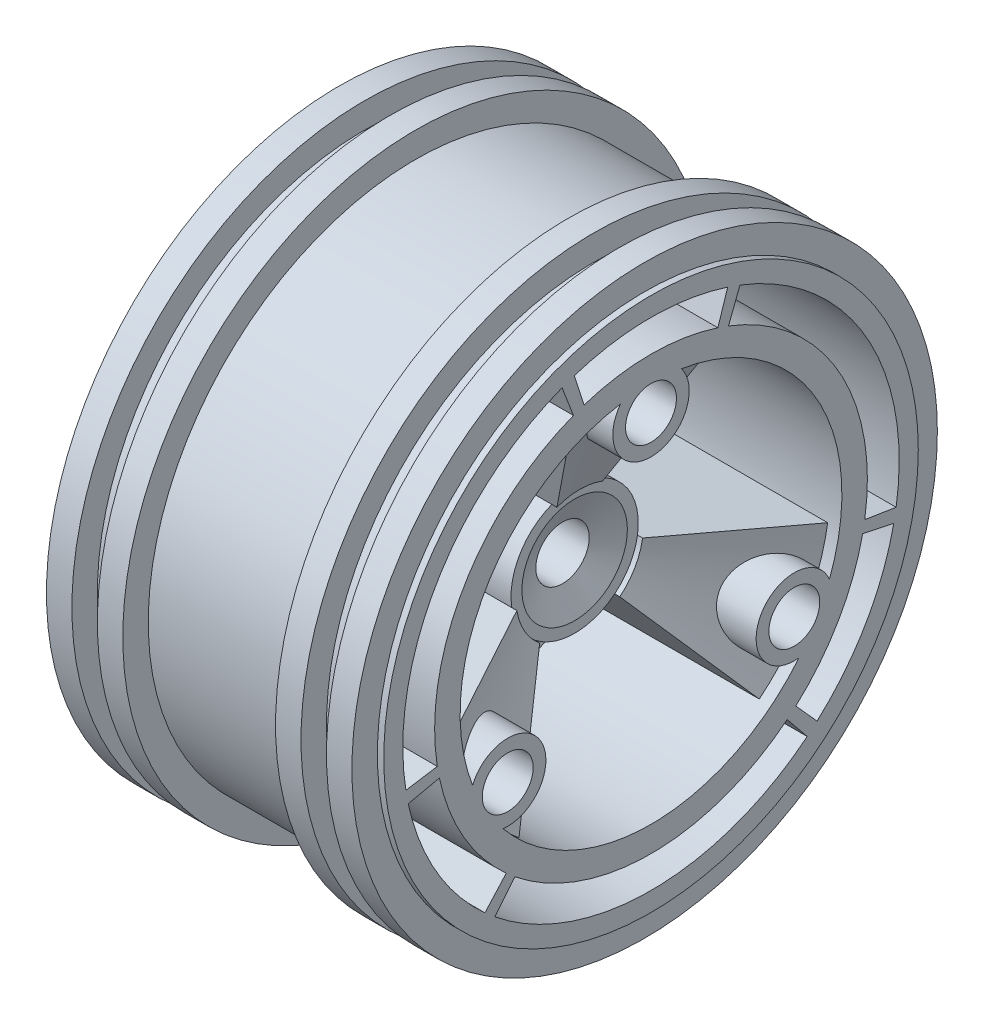
from build123d import *

# Parameters (mm, degrees)
ESQUISSE2_R              = 2
ENL_V_MAT_EXTRU_1_DEPTH  = 20
ESQUISSE2_3_R            = 2.1
ESQUISSE2_3_R_2          = 2
ENL_V_MAT_EXTRU_2_DEPTH  = 20
ENL_V_MAT_EXTRU_3_DEPTH  = 11
ESQUISSE2_6_R            = 3
ENL_V_MAT_EXTRU_4_DEPTH  = 1
ENL_V_MAT_EXTRU_5_DEPTH  = 0.5
ESQUISSE2_8_R            = 19
ESQUISSE2_8_R_2          = 2
BOSS_EXTRU_1_DEPTH       = 19
ENL_V_START              = -15
ENL_V_MAT_EXTRU_6_DEPTH  = 15
ENL_V_START_2            = -6
ENL_V_MAT_EXTRU_9_DEPTH  = 6
ENL_V_START_3            = -14.5
ENL_V_MAT_EXTRU_12_DEPTH = 14.5
ENL_V_MAT_EXTRU_13_DEPTH = 17


with BuildPart() as part:
    # Esquisse1 → Révolution1 (revolve)
    with BuildSketch(Plane.XY):
        Polygon((-6.5, -2), (5.5, -2), (12.5, -17), (12.5, -21), (12, -21), (12, -23), (10, -23), (10, -21), (8, -21), (8, -23), (6, -23), (6, -21), (-6, -21), (-6, -23), (-8, -23), (-8, -21), (-10, -21), (-10, -23), (-12, -23), (-12, -21), (-12.5, -21), (-12.5, -19), (-6.5, -19), align=None)
    revolve(axis=Axis((0, 0, 0), (-1, 0, 0)))

    # Esquisse2 → Enlèv. mat.-Extru.1 (cut)
    with BuildSketch(Plane.ZY.offset(6.5)):
        with Locations((-11.258330249, 6.5)):
            Circle(ESQUISSE2_R)
    extrude(amount=-ENL_V_MAT_EXTRU_1_DEPTH, mode=Mode.SUBTRACT)

    # Esquisse2<3> → Enlèv. mat.-Extru.2 (cut)
    with BuildSketch(Plane.ZY.offset(6.5)):
        Circle(ESQUISSE2_3_R)
        with Locations((11.258330249, -6.5)):
            Circle(ESQUISSE2_3_R_2)
        with Locations((0, 13)):
            Circle(ESQUISSE2_3_R_2)
        with Locations((0, -13)):
            Circle(ESQUISSE2_3_R_2)
        with Locations((-11.258330249, -6.5)):
            Circle(ESQUISSE2_3_R_2)
        with Locations((11.258330249, 6.5)):
            Circle(ESQUISSE2_3_R_2)
    extrude(amount=-ENL_V_MAT_EXTRU_2_DEPTH, mode=Mode.SUBTRACT)

    # Esquisse2<4> → Enlèv. mat.-Extru.3 (cut)
    with BuildSketch(Plane.ZY.offset(6.5)):
        with BuildLine():
            Line((1.710100717, 4.698463104), (5.13030215, 14.095389312))
            ThreePointArc((5.13030215, 14.095389312), (3.779076628, 14.516148933), (2.394211461, 14.807692308))
            ThreePointArc((2.394211461, 14.807692308), (0, 10), (-2.394211461, 14.807692308))
            ThreePointArc((-2.394211461, 14.807692308), (-3.779076628, 14.516148933), (-5.13030215, 14.095389312))
            Line((-5.13030215, 14.095389312), (-1.710100717, 4.698463104))
            ThreePointArc((-1.710100717, 4.698463104), (0, 5), (1.710100717, 4.698463104))
        make_face()
        with BuildLine():
            Line((14.772116295, -2.604722665), (4.924038765, -0.868240888))
            ThreePointArc((4.924038765, -0.868240888), (4.330127019, -2.5), (3.213938048, -3.830222216))
            Line((3.213938048, -3.830222216), (9.641814145, -11.490666647))
            ThreePointArc((9.641814145, -11.490666647), (10.681815427, -10.530850829), (11.626731979, -9.477294101))
            ThreePointArc((11.626731979, -9.477294101), (8.660254038, -5), (14.02094344, -5.330398206))
            ThreePointArc((14.02094344, -5.330398206), (14.460892055, -3.985298104), (14.772116295, -2.604722665))
        make_face()
        with BuildLine():
            ThreePointArc((-3.213938048, -3.830222216), (-4.330127019, -2.5), (-4.924038765, -0.868240888))
            Line((-4.924038765, -0.868240888), (-14.772116295, -2.604722665))
            ThreePointArc((-14.772116295, -2.604722665), (-14.460892055, -3.985298104), (-14.02094344, -5.330398206))
            ThreePointArc((-14.02094344, -5.330398206), (-8.660254038, -5), (-11.626731979, -9.477294101))
            ThreePointArc((-11.626731979, -9.477294101), (-10.681815427, -10.530850829), (-9.641814145, -11.490666647))
            Line((-9.641814145, -11.490666647), (-3.213938048, -3.830222216))
        make_face()
    extrude(amount=-ENL_V_MAT_EXTRU_3_DEPTH, mode=Mode.SUBTRACT)

    # Esquisse2<6> → Enlèv. mat.-Extru.4 (cut)
    with BuildSketch(Plane.ZY.offset(6.5)):
        with BuildLine():
            ThreePointArc((5, 0), (4.095760221, 2.867882182), (1.710100717, 4.698463104))
            ThreePointArc((1.710100717, 4.698463104), (0, 5), (-1.710100717, 4.698463104))
            ThreePointArc((-1.710100717, 4.698463104), (-4.330127019, 2.5), (-4.924038765, -0.868240888))
            ThreePointArc((-4.924038765, -0.868240888), (-4.330127019, -2.5), (-3.213938048, -3.830222216))
            ThreePointArc((-3.213938048, -3.830222216), (0, -5), (3.213938048, -3.830222216))
            ThreePointArc((3.213938048, -3.830222216), (4.330127019, -2.5), (4.924038765, -0.868240888))
            ThreePointArc((4.924038765, -0.868240888), (4.98097349, -0.435778714), (5, 0))
        make_face()
        Circle(ESQUISSE2_6_R, mode=Mode.SUBTRACT)
    extrude(amount=-ENL_V_MAT_EXTRU_4_DEPTH, mode=Mode.SUBTRACT)

    # Esquisse2<7> → Enlèv. mat.-Extru.5 (cut)
    with BuildSketch(Plane.ZY.offset(6.5)):
        with BuildLine():
            ThreePointArc((11.626731979, 9.477294101), (8.690871593, 12.225741325), (5.13030215, 14.095389312))
            Line((5.13030215, 14.095389312), (1.710100717, 4.698463104))
            ThreePointArc((1.710100717, 4.698463104), (4.330127019, 2.5), (4.924038765, -0.868240888))
            Line((4.924038765, -0.868240888), (14.772116295, -2.604722665))
            ThreePointArc((14.772116295, -2.604722665), (14.933238364, 1.413644918), (14.02094344, 5.330398206))
            ThreePointArc((14.02094344, 5.330398206), (8.660254038, 5), (11.626731979, 9.477294101))
        make_face()
        with BuildLine():
            ThreePointArc((-4.924038765, -0.868240888), (-4.330127019, 2.5), (-1.710100717, 4.698463104))
            Line((-1.710100717, 4.698463104), (-5.13030215, 14.095389312))
            ThreePointArc((-5.13030215, 14.095389312), (-8.690871593, 12.225741325), (-11.626731979, 9.477294101))
            ThreePointArc((-11.626731979, 9.477294101), (-8.660254038, 5), (-14.02094344, 5.330398206))
            ThreePointArc((-14.02094344, 5.330398206), (-14.933238364, 1.413644918), (-14.772116295, -2.604722665))
            Line((-14.772116295, -2.604722665), (-4.924038765, -0.868240888))
        make_face()
        with BuildLine():
            Line((9.641814145, -11.490666647), (3.213938048, -3.830222216))
            ThreePointArc((3.213938048, -3.830222216), (0, -5), (-3.213938048, -3.830222216))
            Line((-3.213938048, -3.830222216), (-9.641814145, -11.490666647))
            ThreePointArc((-9.641814145, -11.490666647), (-6.242366771, -13.639386243), (-2.394211461, -14.807692308))
            ThreePointArc((-2.394211461, -14.807692308), (0, -10), (2.394211461, -14.807692308))
            ThreePointArc((2.394211461, -14.807692308), (6.242366771, -13.639386243), (9.641814145, -11.490666647))
        make_face()
    extrude(amount=-ENL_V_MAT_EXTRU_5_DEPTH, mode=Mode.SUBTRACT)

    # Esquisse2<8> → Boss.-Extru.1 (add)
    with BuildSketch(Plane.ZY.offset(6.5)):
        Circle(ESQUISSE2_8_R)
        with Locations((-11.258330249, -6.5)):
            Circle(ESQUISSE2_8_R_2, mode=Mode.SUBTRACT)
        with Locations((0, -13)):
            Circle(ESQUISSE2_8_R_2, mode=Mode.SUBTRACT)
        with BuildLine():
            ThreePointArc((2.394211461, 14.807692308), (3.779076628, 14.516148933), (5.13030215, 14.095389312))
            ThreePointArc((5.13030215, 14.095389312), (8.690871593, 12.225741325), (11.626731979, 9.477294101))
            ThreePointArc((11.626731979, 9.477294101), (8.660254038, 5), (14.02094344, 5.330398206))
            ThreePointArc((14.02094344, 5.330398206), (14.933238364, 1.413644918), (14.772116295, -2.604722665))
            ThreePointArc((14.772116295, -2.604722665), (14.460892055, -3.985298104), (14.02094344, -5.330398206))
            ThreePointArc((14.02094344, -5.330398206), (8.660254038, -5), (11.626731979, -9.477294101))
            ThreePointArc((11.626731979, -9.477294101), (10.681815427, -10.530850829), (9.641814145, -11.490666647))
            ThreePointArc((9.641814145, -11.490666647), (6.242366771, -13.639386243), (2.394211461, -14.807692308))
            ThreePointArc((2.394211461, -14.807692308), (0, -10), (-2.394211461, -14.807692308))
            ThreePointArc((-2.394211461, -14.807692308), (-6.242366771, -13.639386243), (-9.641814145, -11.490666647))
            ThreePointArc((-9.641814145, -11.490666647), (-10.681815427, -10.530850829), (-11.626731979, -9.477294101))
            ThreePointArc((-11.626731979, -9.477294101), (-8.660254038, -5), (-14.02094344, -5.330398206))
            ThreePointArc((-14.02094344, -5.330398206), (-14.460892055, -3.985298104), (-14.772116295, -2.604722665))
            ThreePointArc((-14.772116295, -2.604722665), (-14.933238364, 1.413644918), (-14.02094344, 5.330398206))
            ThreePointArc((-14.02094344, 5.330398206), (-8.660254038, 5), (-11.626731979, 9.477294101))
            ThreePointArc((-11.626731979, 9.477294101), (-8.690871593, 12.225741325), (-5.13030215, 14.095389312))
            ThreePointArc((-5.13030215, 14.095389312), (-3.779076628, 14.516148933), (-2.394211461, 14.807692308))
            ThreePointArc((-2.394211461, 14.807692308), (0, 10), (2.394211461, 14.807692308))
        make_face(mode=Mode.SUBTRACT)
        with Locations((11.258330249, -6.5)):
            Circle(ESQUISSE2_8_R_2, mode=Mode.SUBTRACT)
        with Locations((-11.258330249, 6.5)):
            Circle(ESQUISSE2_8_R_2, mode=Mode.SUBTRACT)
        with Locations((11.258330249, 6.5)):
            Circle(ESQUISSE2_8_R_2, mode=Mode.SUBTRACT)
        with Locations((0, 13)):
            Circle(ESQUISSE2_8_R_2, mode=Mode.SUBTRACT)
    extrude(amount=-BOSS_EXTRU_1_DEPTH)

    # Esquisse7 → Enlèv. mat.-Extru.6 (cut)
    with BuildSketch(Plane(origin=(12.5, 0, 0), x_dir=(0, 0, -1), z_dir=(1, 0, 0)).offset(ENL_V_START)):
        with BuildLine():
            Line((-1.791839748, 4.667902132), (-5.375519243, 14.003706397))
            ThreePointArc((-5.375519243, 14.003706397), (-8.797229037, 12.149434607), (-11.626731979, 9.477294101))
            ThreePointArc((-11.626731979, 9.477294101), (-8.660254038, 5), (-14.02094344, 5.330398206))
            ThreePointArc((-14.02094344, 5.330398206), (-14.92033353, 1.543906525), (-14.815325109, -2.346516976))
            Line((-14.815325109, -2.346516976), (-4.938441703, -0.782172325))
            ThreePointArc((-4.938441703, -0.782172325), (-4.330127019, 2.5), (-1.791839748, 4.667902132))
        make_face()
        with BuildLine():
            ThreePointArc((11.626731979, 9.477294101), (8.797229037, 12.149434607), (5.375519243, 14.003706397))
            Line((5.375519243, 14.003706397), (1.791839748, 4.667902132))
            ThreePointArc((1.791839748, 4.667902132), (4.330127019, 2.5), (4.938441703, -0.782172325))
            Line((4.938441703, -0.782172325), (14.815325109, -2.346516976))
            ThreePointArc((14.815325109, -2.346516976), (14.92033353, 1.543906525), (14.02094344, 5.330398206))
            ThreePointArc((14.02094344, 5.330398206), (8.660254038, 5), (11.626731979, 9.477294101))
        make_face()
        with BuildLine():
            ThreePointArc((3.146601955, -3.885729807), (0, -5), (-3.146601955, -3.885729807))
            Line((-3.146601955, -3.885729807), (-9.439805866, -11.657189422))
            ThreePointArc((-9.439805866, -11.657189422), (-6.123104493, -13.693341132), (-2.394211461, -14.807692308))
            ThreePointArc((-2.394211461, -14.807692308), (0, -10), (2.394211461, -14.807692308))
            ThreePointArc((2.394211461, -14.807692308), (6.123104493, -13.693341132), (9.439805866, -11.657189422))
            Line((9.439805866, -11.657189422), (3.146601955, -3.885729807))
        make_face()
    extrude(amount=ENL_V_MAT_EXTRU_6_DEPTH, mode=Mode.SUBTRACT)

    # Esquisse7<5> → Enlèv. mat.-Extru.9 (cut)
    with BuildSketch(Plane(origin=(12.5, 0, 0), x_dir=(0, 0, -1), z_dir=(1, 0, 0)).offset(ENL_V_START_2)):
        with BuildLine():
            ThreePointArc((1.791839748, 4.667902132), (0, 5), (-1.791839748, 4.667902132))
            ThreePointArc((-1.791839748, 4.667902132), (-4.330127019, 2.5), (-4.938441703, -0.782172325))
            ThreePointArc((-4.938441703, -0.782172325), (-4.330127019, -2.5), (-3.146601955, -3.885729807))
            ThreePointArc((-3.146601955, -3.885729807), (0, -5), (3.146601955, -3.885729807))
            ThreePointArc((3.146601955, -3.885729807), (4.330127019, -2.5), (4.938441703, -0.782172325))
            ThreePointArc((4.938441703, -0.782172325), (4.984586669, -0.392295479), (5, 0))
            ThreePointArc((5, 0), (4.120630943, 2.832031185), (1.791839748, 4.667902132))
        make_face()
        with BuildLine():
            ThreePointArc((3, 0), (2.707755853, -1.29153329), (1.887961173, -2.331437884))
            ThreePointArc((1.887961173, -2.331437884), (-2.707755853, 1.29153329), (3, 0))
        make_face(mode=Mode.SUBTRACT)
    extrude(amount=ENL_V_MAT_EXTRU_9_DEPTH, mode=Mode.SUBTRACT)

    # Esquisse13 → Enlèv. mat.-Extru.12 (cut)
    with BuildSketch(Plane(origin=(12.5, 0, 0), x_dir=(0, 0, -1), z_dir=(1, 0, 0)).offset(ENL_V_START_3)):
        with BuildLine():
            ThreePointArc((11.626731979, 9.477294101), (8.660254038, 5), (14.02094344, 5.330398206))
            ThreePointArc((14.02094344, 5.330398206), (12.990381057, 7.5), (11.626731979, 9.477294101))
        make_face()
        with BuildLine():
            ThreePointArc((-14.02094344, 5.330398206), (-8.660254038, 5), (-11.626731979, 9.477294101))
            ThreePointArc((-11.626731979, 9.477294101), (-12.990381057, 7.5), (-14.02094344, 5.330398206))
        make_face()
        with BuildLine():
            ThreePointArc((2.394211461, -14.807692308), (0, -10), (-2.394211461, -14.807692308))
            ThreePointArc((-2.394211461, -14.807692308), (0, -15), (2.394211461, -14.807692308))
        make_face()
    extrude(amount=ENL_V_MAT_EXTRU_12_DEPTH, mode=Mode.SUBTRACT)

    # Esquisse14 → Enlèv. mat.-Extru.13 (cut)
    with BuildSketch(Plane(origin=(12.5, 0, 0), x_dir=(0, 0, -1), z_dir=(1, 0, 0))):
        with BuildLine():
            Line((6.988175016, 18.204818317), (6.092255142, 15.87086725))
            ThreePointArc((6.092255142, 15.87086725), (14.722431864, 8.5), (16.79070179, -2.659385906))
            Line((16.79070179, -2.659385906), (19.259922642, -3.050472068))
            ThreePointArc((19.259922642, -3.050472068), (16.887495374, 9.75), (6.988175016, 18.204818317))
        make_face()
        with BuildLine():
            ThreePointArc((-16.79070179, -2.659385906), (-14.722431864, 8.5), (-6.092255142, 15.87086725))
            Line((-6.092255142, 15.87086725), (-6.988175016, 18.204818317))
            ThreePointArc((-6.988175016, 18.204818317), (-16.887495374, 9.75), (-19.259922642, -3.050472068))
            Line((-19.259922642, -3.050472068), (-16.79070179, -2.659385906))
        make_face()
        with BuildLine():
            ThreePointArc((10.698446648, -13.211481345), (0, -17), (-10.698446648, -13.211481345))
            Line((-10.698446648, -13.211481345), (-12.271747625, -15.154346248))
            ThreePointArc((-12.271747625, -15.154346248), (0, -19.5), (12.271747625, -15.154346248))
            Line((12.271747625, -15.154346248), (10.698446648, -13.211481345))
        make_face()
        with BuildLine():
            ThreePointArc((-5.253288904, 16.167960777), (0, 17), (5.253288904, 16.167960777))
            Line((5.253288904, 16.167960777), (6.02583139, 18.545602068))
            ThreePointArc((6.02583139, 18.545602068), (0, 19.5), (-6.02583139, 18.545602068))
            Line((-6.02583139, 18.545602068), (-5.253288904, 16.167960777))
        make_face()
        with BuildLine():
            Line((-13.048046824, -14.491324097), (-11.375220308, -12.633462033))
            ThreePointArc((-11.375220308, -12.633462033), (-14.722431864, -8.5), (-16.628509212, -3.534498744))
            Line((-16.628509212, -3.534498744), (-19.073878214, -4.054277971))
            ThreePointArc((-19.073878214, -4.054277971), (-16.887495374, -9.75), (-13.048046824, -14.491324097))
        make_face()
        with BuildLine():
            ThreePointArc((16.628509212, -3.534498744), (14.722431864, -8.5), (11.375220308, -12.633462033))
            Line((11.375220308, -12.633462033), (13.048046824, -14.491324097))
            ThreePointArc((13.048046824, -14.491324097), (16.887495374, -9.75), (19.073878214, -4.054277971))
            Line((19.073878214, -4.054277971), (16.628509212, -3.534498744))
        make_face()
    extrude(amount=-ENL_V_MAT_EXTRU_13_DEPTH, mode=Mode.SUBTRACT)


solid = part.part
